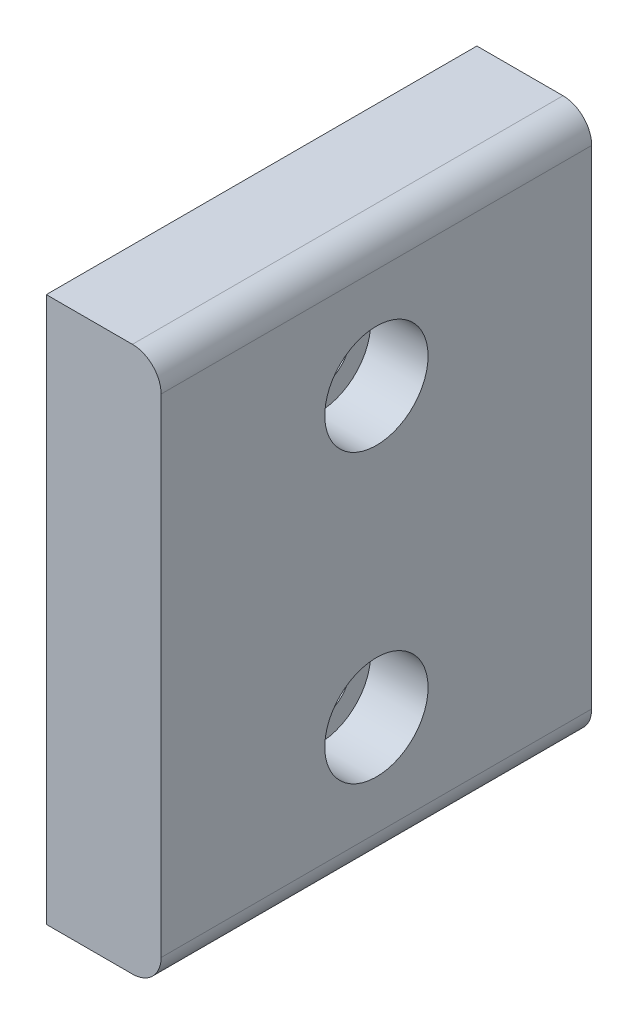
from build123d import *

# Parameters (mm, degrees)
SKETCH_1_W          = 15
SKETCH_1_H          = 19
SKETCH_1_R          = 1.1
EXTRUDE_1_DEPTH     = 4
SKETCH_2_R          = 1.8
CUT_EXTRUDE_1_DEPTH = 2
FILLET_1_R          = 1


with BuildPart() as part:
    # Эскиз1 → Бобышка-Вытянуть1 (new body)
    with BuildSketch(Plane(origin=(0, 0, 0), x_dir=(0, 0, -1), z_dir=(1, 0, 0))):
        Rectangle(SKETCH_1_W, SKETCH_1_H)
        with Locations((0, 5)):
            Circle(SKETCH_1_R, mode=Mode.SUBTRACT)
        with Locations((0, -5)):
            Circle(SKETCH_1_R, mode=Mode.SUBTRACT)
    extrude(amount=EXTRUDE_1_DEPTH)

    # Эскиз2 → Вырез-Вытянуть1 (cut)
    with BuildSketch(Plane(origin=(4, 0, 0), x_dir=(0, 0, -1), z_dir=(1, 0, 0))):
        with Locations((0, 5)):
            Circle(SKETCH_2_R)
        with Locations((0, -5)):
            Circle(SKETCH_2_R)
    extrude(amount=-CUT_EXTRUDE_1_DEPTH, mode=Mode.SUBTRACT)

    # Скругление1
    fillet_1_edges = [part.edges().sort_by_distance(p)[0] for p in [
        (4, -9.5, 0),
        (4, 9.5, 0),
    ]]
    fillet(fillet_1_edges, radius=FILLET_1_R)


solid = part.part
